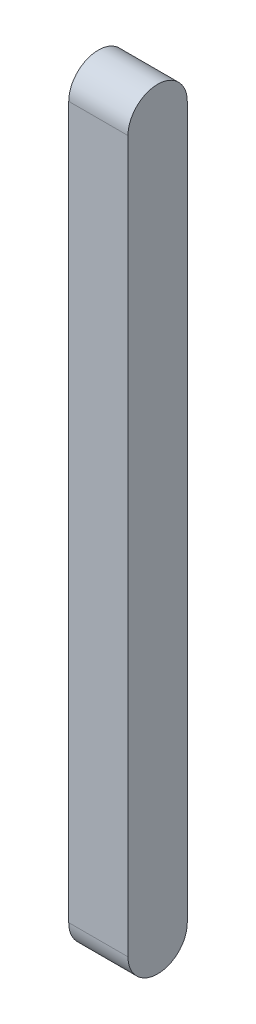
from build123d import *

# Parameters (mm, degrees)
SKETCH_1_R      = 5
SKETCH_1_W      = 10
SKETCH_1_H      = 120
EXTRUDE_1_DEPTH = 10


with BuildPart() as part:
    # 草图1 → 凸台-拉伸1 (new body)
    with BuildSketch(Plane(origin=(0, 0, 0), x_dir=(0, 0, -1), z_dir=(1, 0, 0))):
        with Locations((0, 60)):
            Circle(SKETCH_1_R)
        with Locations((0, -60)):
            Circle(SKETCH_1_R)
        Rectangle(SKETCH_1_W, SKETCH_1_H)
    extrude(amount=EXTRUDE_1_DEPTH)


solid = part.part
